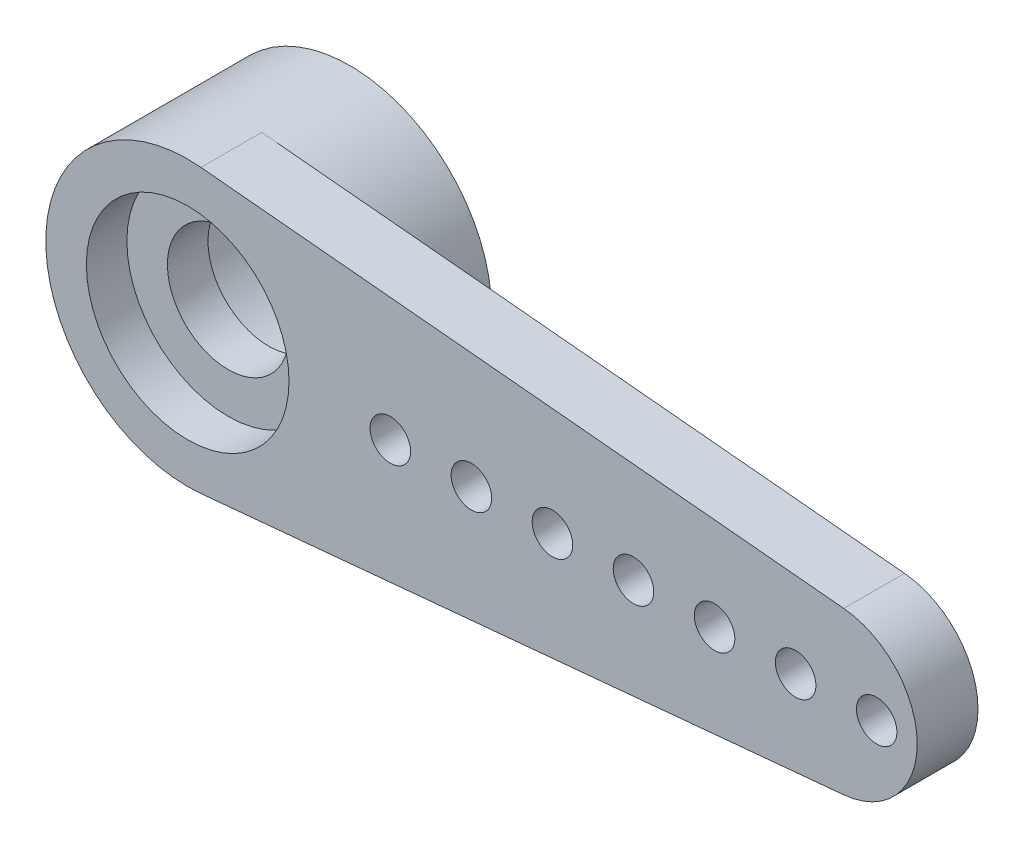
from build123d import *

# Parameters (mm, degrees)
SKETCH_1_R          = 3.5
EXTRUDE_1_DEPTH     = 4
EXTRUDE_START       = -1.5
EXTRUDE_2_DEPTH     = 1.5
SKETCH_3_R          = 0.5
CUT_EXTRUDE_1_DEPTH = 1.5
SKETCH_4_R          = 1.5
CUT_EXTRUDE_2_DEPTH = 55
SKETCH_5_R          = 2.5
CUT_EXTRUDE_3_DEPTH = 2
CUT_EXTRUDE_START   = -1
SKETCH_6_R          = 2.5
CUT_EXTRUDE_4_DEPTH = 1


with BuildPart() as part:
    # 草图1 → 凸台-拉伸1 (new body)
    with BuildSketch(Plane.XY):
        Circle(SKETCH_1_R)
    extrude(amount=EXTRUDE_1_DEPTH)

    # 草图2 → 凸台-拉伸2 (add)
    with BuildSketch(Plane.XY.offset(4).offset(EXTRUDE_START)):
        with BuildLine():
            Line((0.328125, 3.484585195), (16.1875, 1.99119154))
            ThreePointArc((16.1875, 1.99119154), (18, 0), (16.1875, -1.99119154))
            Line((16.1875, -1.99119154), (0.328125, -3.484585195))
            ThreePointArc((0.328125, -3.484585195), (3.5, 0), (0.328125, 3.484585195))
        make_face()
    extrude(amount=EXTRUDE_2_DEPTH)

    # 草图3 → 切除-拉伸1 (cut)
    with BuildSketch(Plane(origin=(0, 0, 2.5), x_dir=(-1, 0, 0), z_dir=(0, 0, -1))):
        with Locations((-7, 0)):
            Circle(SKETCH_3_R)
        with Locations((-9, 0)):
            Circle(SKETCH_3_R)
        with Locations((-11, 0)):
            Circle(SKETCH_3_R)
        with Locations((-13, 0)):
            Circle(SKETCH_3_R)
        with Locations((-15, 0)):
            Circle(SKETCH_3_R)
        with Locations((-5, 0)):
            Circle(SKETCH_3_R)
        with Locations((-17, 0)):
            Circle(SKETCH_3_R)
    extrude(amount=-CUT_EXTRUDE_1_DEPTH, mode=Mode.SUBTRACT)

    # 草图4 → 切除-拉伸2 (cut)
    with BuildSketch(Plane(origin=(0, 0, 0), x_dir=(-1, 0, 0), z_dir=(0, 0, -1))):
        Circle(SKETCH_4_R)
    extrude(amount=-CUT_EXTRUDE_2_DEPTH, mode=Mode.SUBTRACT)

    # 草图5 → 切除-拉伸3 (cut)
    with BuildSketch(Plane(origin=(0, 0, 0), x_dir=(-1, 0, 0), z_dir=(0, 0, -1))):
        Circle(SKETCH_5_R)
    extrude(amount=-CUT_EXTRUDE_3_DEPTH, mode=Mode.SUBTRACT)

    # 草图6 → 切除-拉伸4 (cut)
    with BuildSketch(Plane.XY.offset(4).offset(CUT_EXTRUDE_START)):
        with Locations(Location((0, 0, 0), (0, 0, 180))):
            Circle(SKETCH_6_R)
    extrude(amount=CUT_EXTRUDE_4_DEPTH, mode=Mode.SUBTRACT)


solid = part.part
